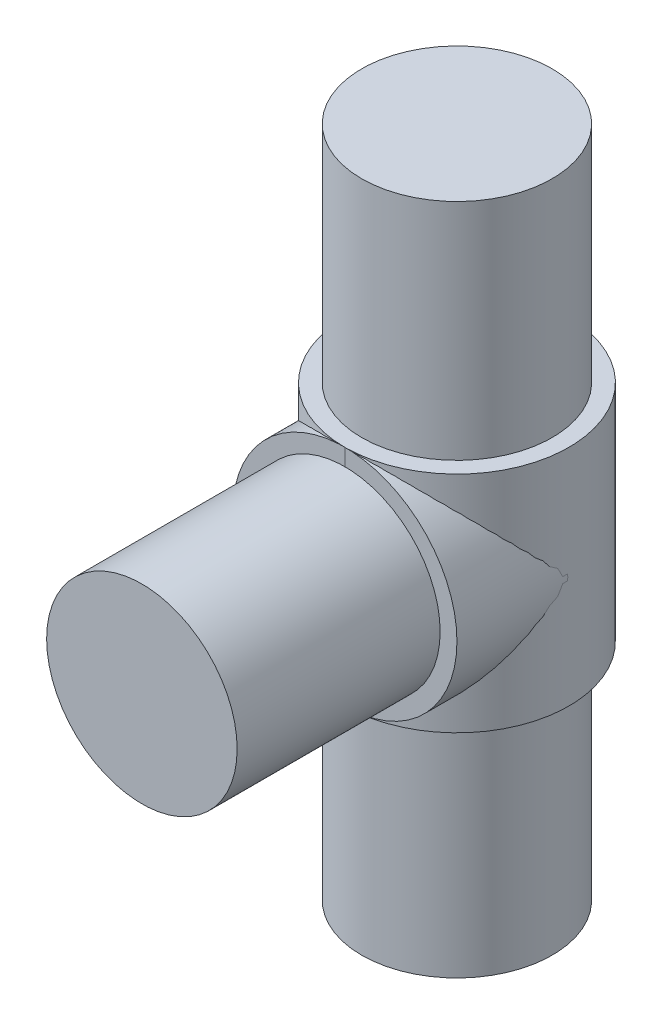
from build123d import *

# Parameters (mm, degrees)
SKETCH1_R                 = 8.5
BOSS_EXTRUDE9_DEPTH       = 60
BOSS_EXTRUDE10_DEPTH      = 15.5
BOSS_EXTRUDE10_DEPTH_BACK = 13
SKETCH2_R                 = 8.5
BOSS_EXTRUDE11_DEPTH      = 0.0001
BOSS_EXTRUDE11_DEPTH_BACK = 38.5
SKETCH3_R                 = 10
MOVE_FACE1_BY             = 20.2
BOSS_EXTRUDE12_DEPTH      = 0.0001
BOSS_EXTRUDE12_DEPTH_BACK = 28
SKETCH4_R                 = 10
MOVE_FACE2_BY             = 18.6
MOVE_FACE3_BY             = 0.198659162
MOVE_FACE4_BY             = 1.493864333
MOVE_FACE6_BY             = 0.604242716
MOVE_FACE7_BY             = 0.11593398


with BuildPart() as part:
    # Sketch1 → Boss-Extrude9 (new body)
    with BuildSketch(Plane(origin=(0, 0, 0), x_dir=(1, 0, 0), z_dir=(0, 1, 0))):
        with Locations(Location((-50.889224798, 12.609280988, 0), (0, 0, 270))):
            Circle(SKETCH1_R)
    extrude(amount=BOSS_EXTRUDE9_DEPTH)


with BuildPart() as body_2:
    # Sketch2 → Boss-Extrude10 (new, two sides: drawn at the far end of the back side and taken through both)
    with BuildSketch(Plane.XY.offset(-BOSS_EXTRUDE10_DEPTH_BACK)):
        with Locations((-50.889224798, 30)):
            Circle(SKETCH2_R)
    extrude(amount=BOSS_EXTRUDE10_DEPTH + BOSS_EXTRUDE10_DEPTH_BACK)


with BuildPart() as body_3:
    # Sketch3 → Boss-Extrude11 (new, two sides: drawn at the far end of the back side and taken through both)
    with BuildSketch(Plane(origin=(0, 60, 0), x_dir=(1, 0, 0), z_dir=(0, 1, 0)).offset(-BOSS_EXTRUDE11_DEPTH_BACK)):
        with Locations(Location((-50.889224798, 12.609280988, 0), (0, 0, 270))):
            Circle(SKETCH3_R)
    extrude(amount=BOSS_EXTRUDE11_DEPTH + BOSS_EXTRUDE11_DEPTH_BACK)

    # Move Face1: a face moved inward by 20.2
    extrude(body_3.faces().sort_by_distance((-50.889224798, 60.0001, -12.609280988))[0], amount=MOVE_FACE1_BY, dir=(0, -1, 0), mode=Mode.SUBTRACT)

    # Move Face3: a face moved outward by 0.198659
    extrude(body_3.faces().sort_by_distance((-50.889224798, 39.8001, -12.609280988))[0], amount=MOVE_FACE3_BY, dir=(0, 1, 0))

    # Move Face4: a face moved outward by 1.493864
    extrude(body_3.faces().sort_by_distance((-50.889224798, 21.5, -12.609280988))[0], amount=MOVE_FACE4_BY, dir=(0, -1, 0))


with BuildPart() as body_4:
    # Sketch4 → Boss-Extrude12 (new, two sides: drawn at the far end of the back side and taken through both)
    with BuildSketch(Plane.XY.offset(15.5).offset(-BOSS_EXTRUDE12_DEPTH_BACK)):
        with Locations((-50.889224798, 30)):
            Circle(SKETCH4_R)
    extrude(amount=BOSS_EXTRUDE12_DEPTH + BOSS_EXTRUDE12_DEPTH_BACK)

    # Move Face2: a face moved inward by 18.6
    extrude(body_4.faces().sort_by_distance((-50.889224798, 30, 15.5001))[0], amount=MOVE_FACE2_BY, dir=(0, 0, -1), mode=Mode.SUBTRACT)

    # Move Face6: a face moved outward by 0.604243
    extrude(body_4.faces().sort_by_distance((-50.889224798, 30, -3.0999))[0], amount=MOVE_FACE6_BY, dir=(0, 0, 1))

    # Move Face7: a face moved inward by 0.115934
    extrude(body_4.faces().sort_by_distance((-50.889224798, 30, -2.495657284))[0], amount=MOVE_FACE7_BY, dir=(0, 0, -1), mode=Mode.SUBTRACT)


solid = Compound([part.part, body_2.part, body_3.part, body_4.part])
